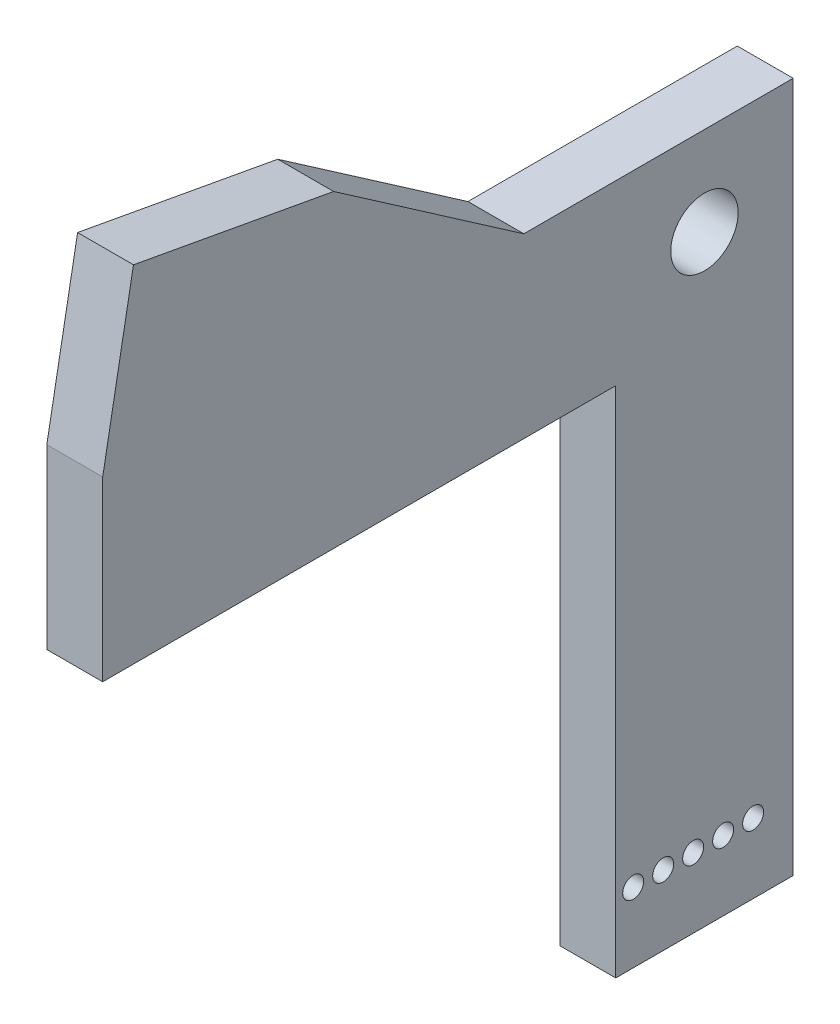
from build123d import *

# Parameters (mm, degrees)
SKETCH1_R           = 2.413
SKETCH1_R_2         = 0.75
BOSS_EXTRUDE1_DEPTH = 2


with BuildPart() as part:
    # Sketch1 → Boss-Extrude1 (new, symmetric)
    with BuildSketch(Plane(origin=(0, 0, 0), x_dir=(0, 0, -1), z_dir=(1, 0, 0))):
        Polygon((-40.864531886, 18.395870563), (-43.06614877, 6.35), (-43.06614877, -6.35), (-6.35, -6.35), (-6.35, -43.06614877), (6.35, -43.06614877), (6.35, 6.35), (-12.928006667, 6.35), (-26.539165493, 15.777631529), align=None)
        Circle(SKETCH1_R, mode=Mode.SUBTRACT)
        with Locations((3.481818182, -38.06614877)):
            Circle(SKETCH1_R_2, mode=Mode.SUBTRACT)
        with Locations((1.336363636, -38.06614877)):
            Circle(SKETCH1_R_2, mode=Mode.SUBTRACT)
        with Locations((-5.1, -38.06614877)):
            Circle(SKETCH1_R_2, mode=Mode.SUBTRACT)
        with Locations((-2.954545455, -38.06614877)):
            Circle(SKETCH1_R_2, mode=Mode.SUBTRACT)
        with Locations((-0.809090909, -38.06614877)):
            Circle(SKETCH1_R_2, mode=Mode.SUBTRACT)
    extrude(amount=BOSS_EXTRUDE1_DEPTH, both=True)


solid = part.part
